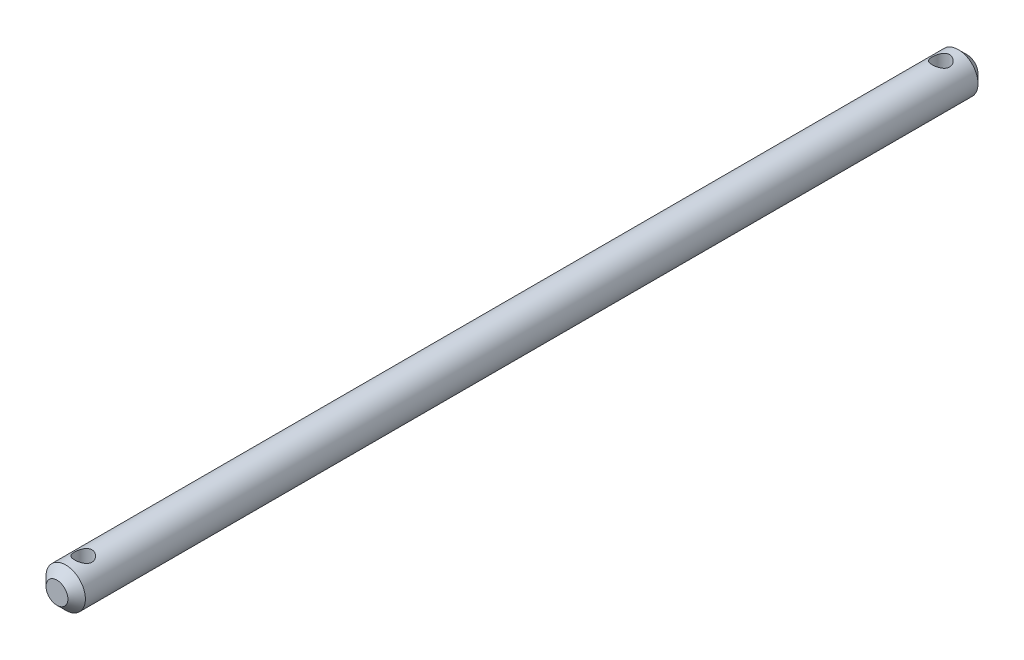
from build123d import *

# Parameters (mm, degrees)
SKETCH_1_R               = 2.25
EXTRUDE_1_DEPTH          = 104
CHAMFER_1_SIZE           = 1
CUT_EXTRUDE_1_DEPTH      = 105.048666498
CUT_EXTRUDE_1_DEPTH_BACK = 105.048666498
SKETCH_2_R               = 1


with BuildPart() as part:
    # 草圖1 → 填料-伸長1 (new body)
    with BuildSketch(Plane.XY):
        with Locations(Location((0, 0, 0), (0, 0, 180))):
            Circle(SKETCH_1_R)
    extrude(amount=EXTRUDE_1_DEPTH)

    # 導角1
    chamfer_1_edges = [part.edges().sort_by_distance(p)[0] for p in [
        (2.25, 0, 0),
        (2.25, 0, 104),
    ]]
    chamfer(chamfer_1_edges, length=CHAMFER_1_SIZE)

    # 草圖2 → 除料-伸長1 (cut, two sides: drawn at the far end of the back side and taken through both)
    with BuildSketch(Plane(origin=(0, 0, 0), x_dir=(1, 0, 0), z_dir=(0, 1, 0)).offset(-CUT_EXTRUDE_1_DEPTH_BACK)):
        with Locations(Location((0, -3, 0), (0, 0, 270))):
            Circle(SKETCH_2_R)
        with Locations(Location((0, -101, 0), (0, 0, 270))):
            Circle(SKETCH_2_R)
    extrude(amount=CUT_EXTRUDE_1_DEPTH + CUT_EXTRUDE_1_DEPTH_BACK, mode=Mode.SUBTRACT)


solid = part.part
